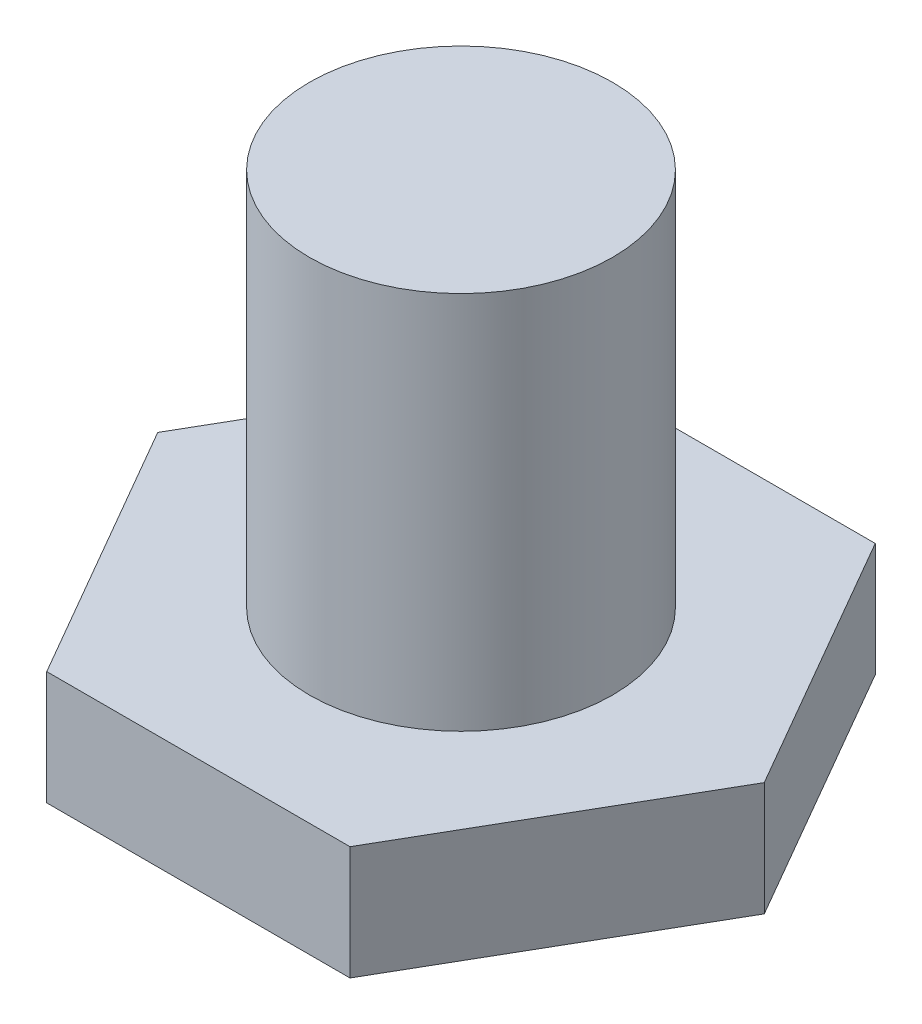
from build123d import *

# Parameters (mm, degrees)
EXTRUDE_1_DEPTH = 1.5
SKETCH_2_R      = 2
EXTRUDE_2_DEPTH = 5


with BuildPart() as part:
    # 草图1 → 凸台-拉伸1 (new body)
    with BuildSketch(Plane(origin=(0, 0, 0), x_dir=(1, 0, 0), z_dir=(0, 1, 0))):
        Polygon((4, 0), (2, 3.464101615), (-2, 3.464101615), (-4, 0), (-2, -3.464101615), (2, -3.464101615), align=None)
    extrude(amount=EXTRUDE_1_DEPTH)

    # 草图2 → 凸台-拉伸2 (add)
    with BuildSketch(Plane(origin=(0, 1.5, 0), x_dir=(1, 0, 0), z_dir=(0, 1, 0))):
        with Locations(Location((0, 0, 0), (0, 0, 270))):
            Circle(SKETCH_2_R)
    extrude(amount=EXTRUDE_2_DEPTH)


solid = part.part
